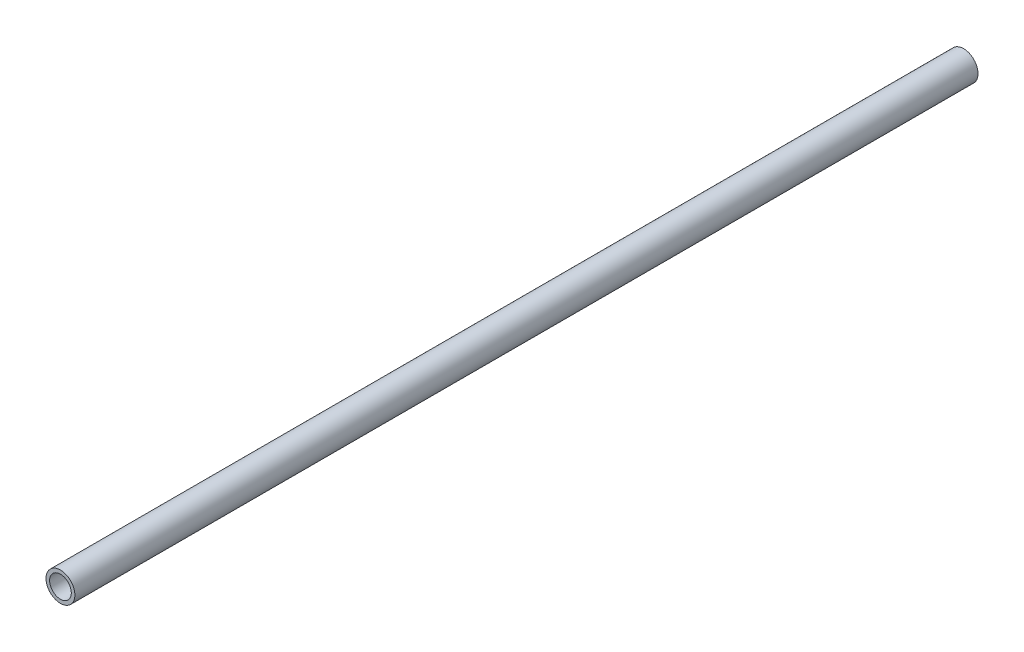
from build123d import *

# Parameters (mm, degrees)
SKETCH1_R           = 12.7
BOSS_EXTRUDE1_DEPTH = 793.75
SHELL1_T            = -3.175


with BuildPart() as part:
    # Sketch1 → Boss-Extrude1 (new body)
    with BuildSketch(Plane.XY):
        with Locations(Location((0, 0, 0), (0, 0, 180))):
            Circle(SKETCH1_R)
    extrude(amount=BOSS_EXTRUDE1_DEPTH)

    # Shell1
    shell1_openings = [part.faces().sort_by_distance(p)[0] for p in [
        (0, 0, 793.75),
        (0, 0, 0),
    ]]
    offset(amount=SHELL1_T, openings=shell1_openings, kind=Kind.INTERSECTION)


solid = part.part
